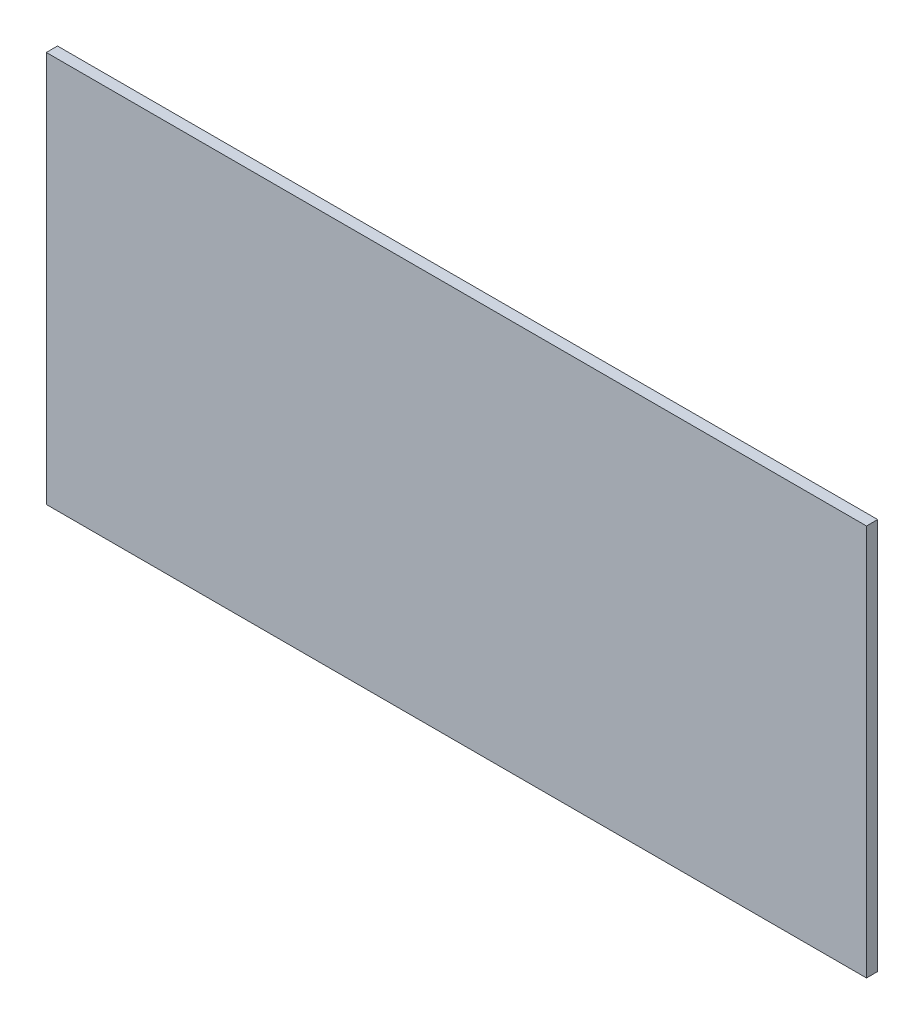
from build123d import *

# Parameters (mm, degrees)
SKETCH1_W           = 279.4
SKETCH1_H           = 133.35
BOSS_EXTRUDE1_DEPTH = 3.81


with BuildPart() as part:
    # Sketch1 → Boss-Extrude1 (new body)
    with BuildSketch(Plane.XY):
        Rectangle(SKETCH1_W, SKETCH1_H)
    extrude(amount=BOSS_EXTRUDE1_DEPTH)


solid = part.part
